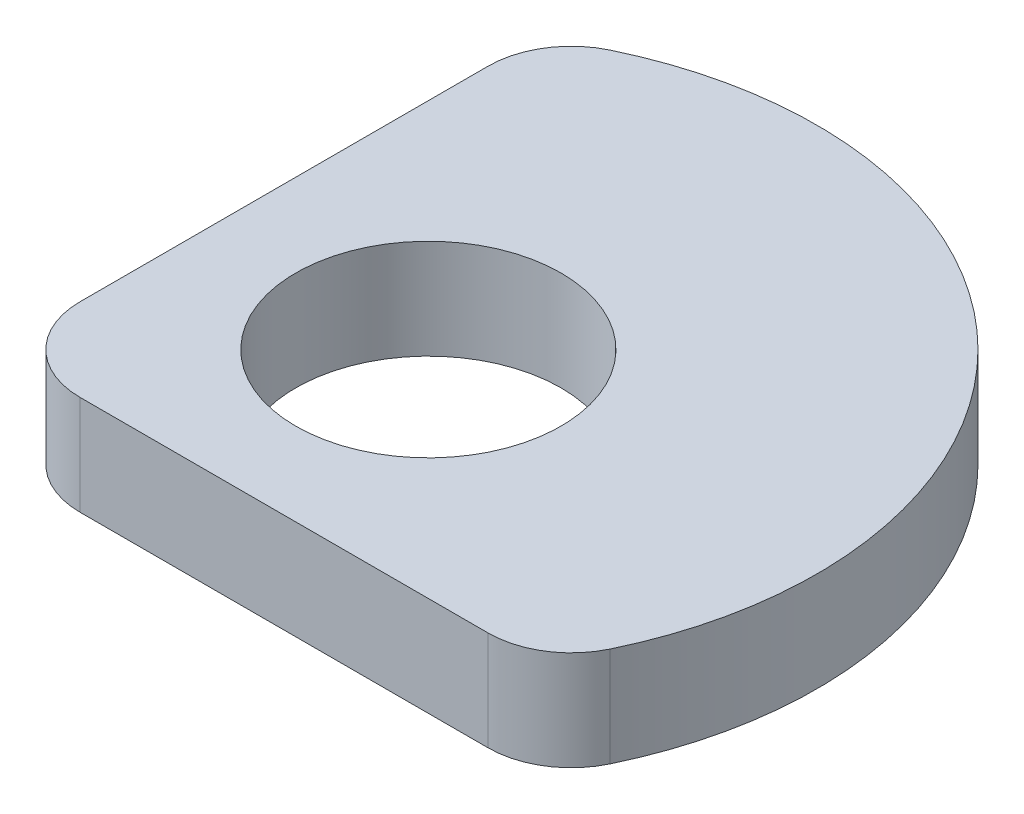
from build123d import *

# Parameters (mm, degrees)
SKETCH1_R           = 1.6
BOSS_EXTRUDE1_DEPTH = 1.2
FILLET1_R           = 1


with BuildPart() as part:
    # Sketch1 → Boss-Extrude1 (new body)
    with BuildSketch(Plane(origin=(0, 0, 0), x_dir=(1, 0, 0), z_dir=(0, 1, 0))):
        with BuildLine():
            Line((0, 0), (6.5, 0))
            ThreePointArc((6.5, 0), (5.914362684, 5.914362684), (0, 6.5))
            Line((0, 6.5), (0, 0))
        make_face()
        with Locations(Location((2.6, 2.6, 0), (0, 0, 270))):
            Circle(SKETCH1_R, mode=Mode.SUBTRACT)
    extrude(amount=BOSS_EXTRUDE1_DEPTH)

    # Fillet1
    fillet1_edges = [part.edges().sort_by_distance(p)[0] for p in [
        (0, 0.6, -6.5),
        (6.5, 0.6, 0),
        (0, 0.6, 0),
    ]]
    fillet(fillet1_edges, radius=FILLET1_R)


solid = part.part
